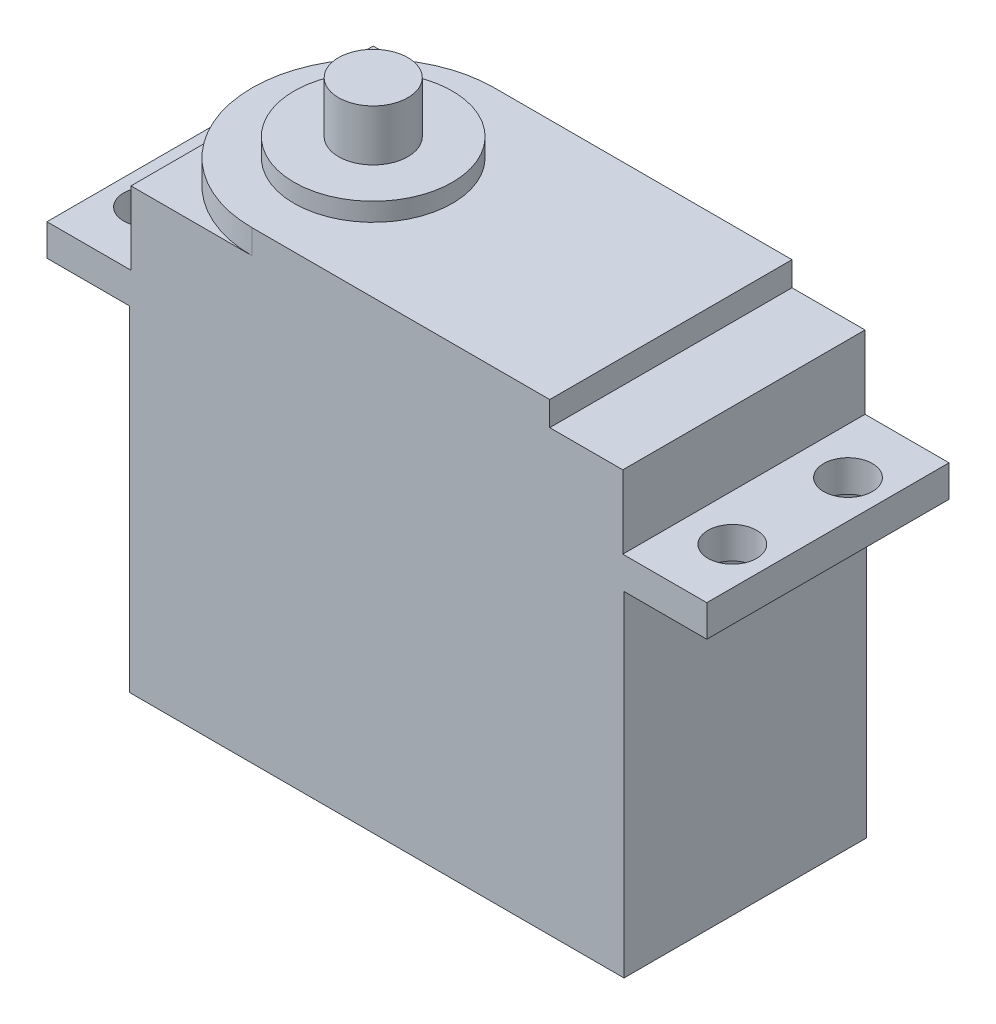
from build123d import *

# Parameters (mm, degrees)
SKETCH1_W           = 40.6
SKETCH1_H           = 19.9
BOSS_EXTRUDE1_DEPTH = 27.5
SKETCH2_W           = 54.2
SKETCH2_H           = 19.9
SKETCH2_R           = 2
BOSS_EXTRUDE2_DEPTH = 2.6
SKETCH3_W           = 40.4
SKETCH3_H           = 19.9
BOSS_EXTRUDE3_DEPTH = 6
SKETCH4_R           = 9.95
BOSS_EXTRUDE4_DEPTH = 2
SKETCH5_R           = 6.5
BOSS_EXTRUDE5_DEPTH = 1.5
SKETCH6_R           = 2.85
BOSS_EXTRUDE6_DEPTH = 4.2


with BuildPart() as part:
    # Sketch1 → Boss-Extrude1 (new body)
    with BuildSketch(Plane(origin=(0, 0, 0), x_dir=(1, 0, 0), z_dir=(0, 1, 0))):
        Rectangle(SKETCH1_W, SKETCH1_H)
    extrude(amount=BOSS_EXTRUDE1_DEPTH)

    # Sketch2 → Boss-Extrude2 (add)
    with BuildSketch(Plane(origin=(0, 27.5, 0), x_dir=(1, 0, 0), z_dir=(0, 1, 0))):
        Rectangle(SKETCH2_W, SKETCH2_H)
        with Locations(Location((-24, 4.75, 0), (0, 0, 270))):
            Circle(SKETCH2_R, mode=Mode.SUBTRACT)
        with Locations(Location((-24, -4.75, 0), (0, 0, 270))):
            Circle(SKETCH2_R, mode=Mode.SUBTRACT)
        with Locations(Location((24, -4.75, 0), (0, 0, 90))):
            Circle(SKETCH2_R, mode=Mode.SUBTRACT)
        with Locations(Location((24, 4.75, 0), (0, 0, 90))):
            Circle(SKETCH2_R, mode=Mode.SUBTRACT)
    extrude(amount=BOSS_EXTRUDE2_DEPTH)

    # Sketch3 → Boss-Extrude3 (add)
    with BuildSketch(Plane(origin=(0, 30.1, 0), x_dir=(1, 0, 0), z_dir=(0, 1, 0))):
        Rectangle(SKETCH3_W, SKETCH3_H)
    extrude(amount=BOSS_EXTRUDE3_DEPTH)

    # Sketch4 → Boss-Extrude4 (add)
    with BuildSketch(Plane(origin=(0, 36.1, 0), x_dir=(1, 0, 0), z_dir=(0, 1, 0))):
        with BuildLine():
            Line((14.2, 9.95), (-10.25, 9.95))
            ThreePointArc((-10.25, 9.95), (-3.214287527, 7.035712473), (-0.3, 0))
            ThreePointArc((-0.3, 0), (-3.214287527, -7.035712473), (-10.25, -9.95))
            Line((-10.25, -9.95), (14.2, -9.95))
            Line((14.2, -9.95), (14.2, 9.95))
        make_face()
        with Locations((-10.25, 0)):
            Circle(SKETCH4_R)
    extrude(amount=BOSS_EXTRUDE4_DEPTH)

    # Sketch5 → Boss-Extrude5 (add)
    with BuildSketch(Plane(origin=(0, 38.1, 0), x_dir=(1, 0, 0), z_dir=(0, 1, 0))):
        with Locations(Location((-10.25, 0, 0), (0, 0, 270))):
            Circle(SKETCH5_R)
    extrude(amount=BOSS_EXTRUDE5_DEPTH)

    # Sketch6 → Boss-Extrude6 (add)
    with BuildSketch(Plane(origin=(0, 39.6, 0), x_dir=(1, 0, 0), z_dir=(0, 1, 0))):
        with Locations(Location((-10.25, 0, 0), (0, 0, 270))):
            Circle(SKETCH6_R)
    extrude(amount=BOSS_EXTRUDE6_DEPTH)


solid = part.part
